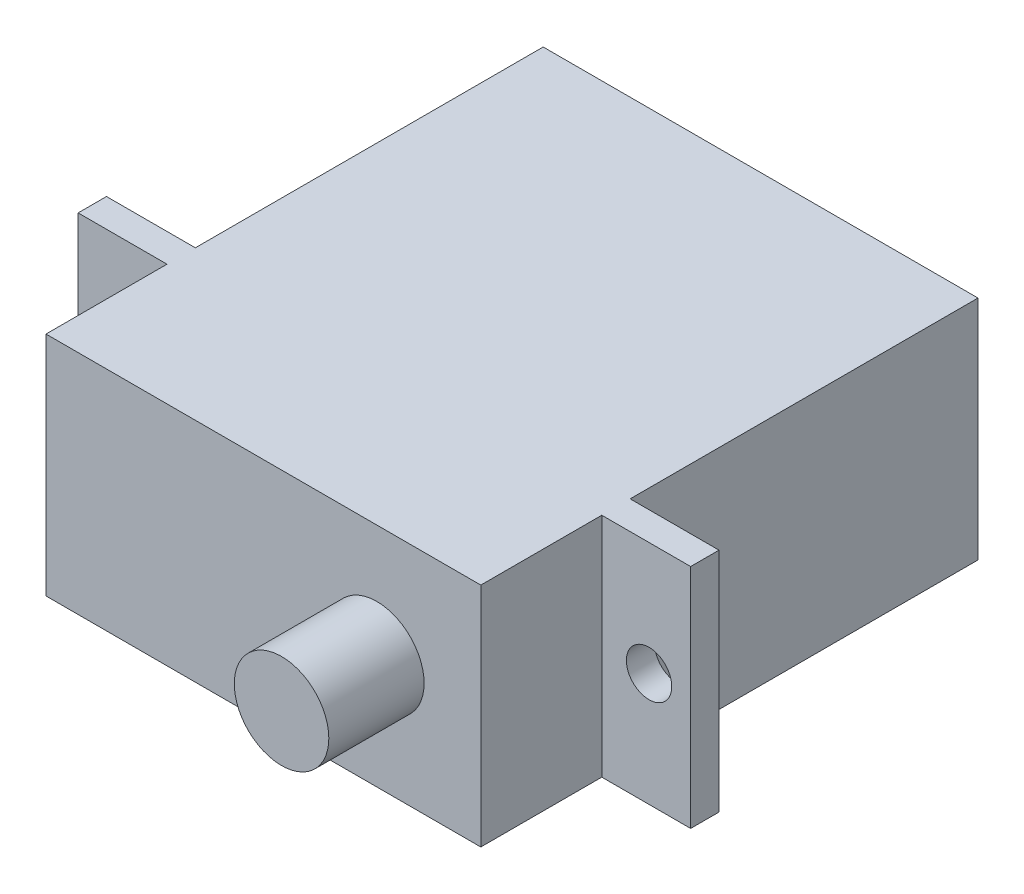
from build123d import *

# Parameters (mm, degrees)
SKETCH_1_W           = 32.4
SKETCH_1_H           = 12
SKETCH_1_R           = 1.2
EXTRUDE_1_DEPTH      = 1.5
EXTRUDE_2_DEPTH      = 6.4
EXTRUDE_2_DEPTH_BACK = 19.9
SKETCH_2_W           = 23
SKETCH_2_H           = 12
SKETCH_3_R           = 2.5
EXTRUDE_3_DEPTH      = 5.04


with BuildPart() as part:
    # 草图1 → 凸台-拉伸1 (new body)
    with BuildSketch(Plane.XY):
        Rectangle(SKETCH_1_W, SKETCH_1_H)
        with Locations((-14, 0)):
            Circle(SKETCH_1_R, mode=Mode.SUBTRACT)
        with Locations(Location((14, 0, 0), (0, 0, 180))):
            Circle(SKETCH_1_R, mode=Mode.SUBTRACT)
    extrude(amount=EXTRUDE_1_DEPTH)

    # 草图2 → 凸台-拉伸2 (add, two sides: drawn at the far end of the back side and taken through both)
    with BuildSketch(Plane.XY.offset(1.5).offset(-EXTRUDE_2_DEPTH_BACK)):
        Rectangle(SKETCH_2_W, SKETCH_2_H)
    extrude(amount=EXTRUDE_2_DEPTH + EXTRUDE_2_DEPTH_BACK)

    # 草图3 → 凸台-拉伸3 (add)
    with BuildSketch(Plane.XY.offset(7.9)):
        with Locations((6, 0)):
            Circle(SKETCH_3_R)
    extrude(amount=EXTRUDE_3_DEPTH)


solid = part.part
